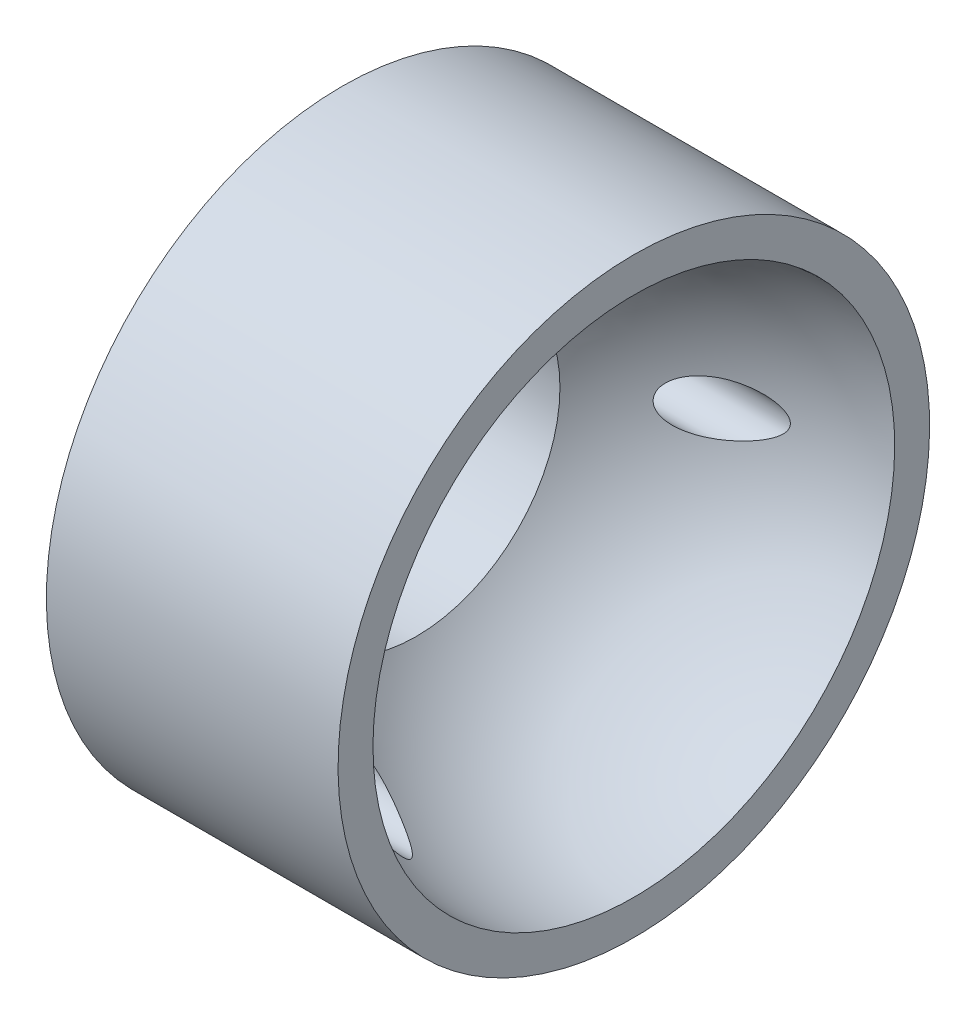
from build123d import *

# Parameters (mm, degrees)
ESQUISSE1_W                             = 14.2
ESQUISSE1_H                             = 14.4
ENL_VEMENT_DE_MATI_RE_R_VOLUTION2_ANGLE = 180
ENL_V_MAT_EXTRU_1_REACH                 = 26.827
ENL_V_MAT_EXTRU_1_END_RADIUS            = 12.7
ESQUISSE5_R                             = 7
DIAM_TRE_DU_PER_AGE_2_5_2_5_1_D         = 2.5


with BuildPart() as part:
    # Esquisse1 → Révolution1 (revolve)
    with BuildSketch(Plane.XY):
        with Locations((7.1, 7.2)):
            Rectangle(ESQUISSE1_W, ESQUISSE1_H)
    revolve(axis=Axis((14.2, 0, 0), (-1, 0, 0)))

    # Esquisse4 → Enlèvement de matière-Révolution2 (revolve, cut)
    with BuildSketch(Plane(origin=(14.2, 0, 0), x_dir=(0, 0, -1), z_dir=(1, 0, 0))):
        with BuildLine():
            Line((5.69655858, -11.350736555), (-5.69655858, 11.350736555))
            Line((-5.69655858, 11.350736555), (-5.698821877, 11.349600399))
            ThreePointArc((-5.698821877, 11.349600399), (-11.350168533, -5.697690257), (5.69655858, -11.350736555))
        make_face()
    revolve(axis=Axis((14.2, -12.018635625, -6.031754993), (0, -0.8937587838633266, -0.4485479196999441)), revolution_arc=ENL_VEMENT_DE_MATI_RE_R_VOLUTION2_ANGLE, mode=Mode.SUBTRACT)

    # Enlèv. mat.-Extru.1: up to this sphere (the profile starts outside it)
    enl_v_mat_extru_1_end = Location((14.2, 0, 0)) * Sphere(ENL_V_MAT_EXTRU_1_END_RADIUS, mode=Mode.PRIVATE)
    # Esquisse5 → Enlèv. mat.-Extru.1 (cut, up to the surface)
    with BuildSketch(Plane.ZY, mode=Mode.PRIVATE) as enl_v_mat_extru_1_sk1:
        with Locations(Location((0, 0, 0), (0, 0, 270))):
            Circle(ESQUISSE5_R)
    enl_v_mat_extru_1_tool1 = extrude(enl_v_mat_extru_1_sk1.sketch, amount=-ENL_V_MAT_EXTRU_1_REACH, mode=Mode.PRIVATE) - enl_v_mat_extru_1_end
    add(enl_v_mat_extru_1_tool1.solids().sort_by_distance((0, 0, 0))[0], mode=Mode.SUBTRACT)

    # Diamètre du perçage Ø2.5 (2.5)1 (through all)
    with Locations(Plane.ZY):
        with Locations((-10.672597122, -0.765291239), (5.999060215, -8.860094612), (4.673536907, 9.625385851)):
            Hole(DIAM_TRE_DU_PER_AGE_2_5_2_5_1_D / 2)


solid = part.part
